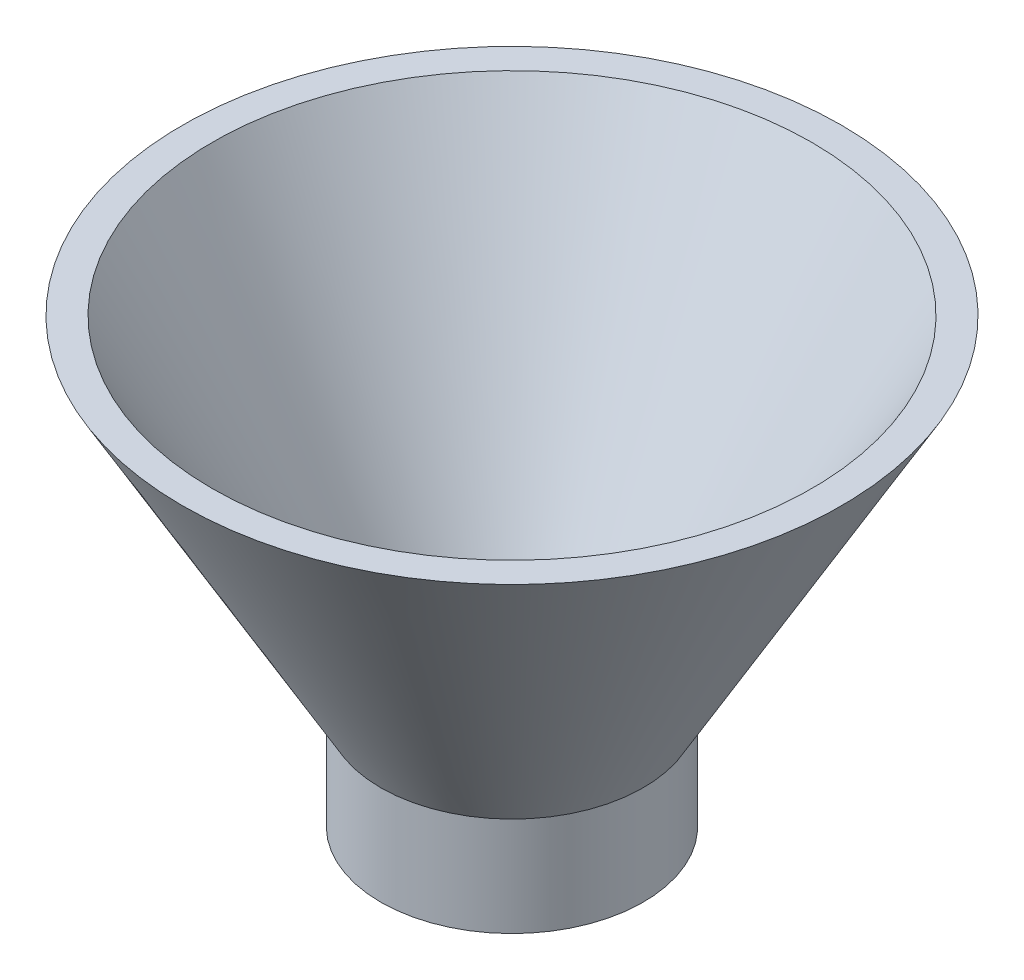
from build123d import *

# Parameters (mm, degrees)
SKETCH1_R           = 13.25
SKETCH1_R_2         = 10.25
BOSS_EXTRUDE1_DEPTH = 10
FILLET1_R           = 10


with BuildPart() as part:
    # Sketch1 → Boss-Extrude1 (new body)
    with BuildSketch(Plane(origin=(0, 0, 0), x_dir=(1, 0, 0), z_dir=(0, 1, 0))):
        with Locations(Location((0, 0, 0), (0, 0, 270))):
            Circle(SKETCH1_R)
        with Locations(Location((0, 0, 0), (0, 0, 270))):
            Circle(SKETCH1_R_2, mode=Mode.SUBTRACT)
    extrude(amount=BOSS_EXTRUDE1_DEPTH)

    # Sketch2 → Revolve1 (revolve)
    with BuildSketch(Plane.XY, mode=Mode.PRIVATE) as revolve1_sk:
        Polygon((-13.25, 10), (-33.25, 44.641016151), (-30.25, 44.641016151), (-10.25, 10), align=None)
    revolve(revolve1_sk.sketch.rotate(Axis((0, 0, 0), (0, 1, 0)), 270), axis=Axis((0, 0, 0), (0, 1, 0)))

    # Fillet1
    fillet1_edges = [part.edges().sort_by_distance(p)[0] for p in [
        (-10.25, 10, 0),
    ]]
    fillet(fillet1_edges, radius=FILLET1_R)


solid = part.part
